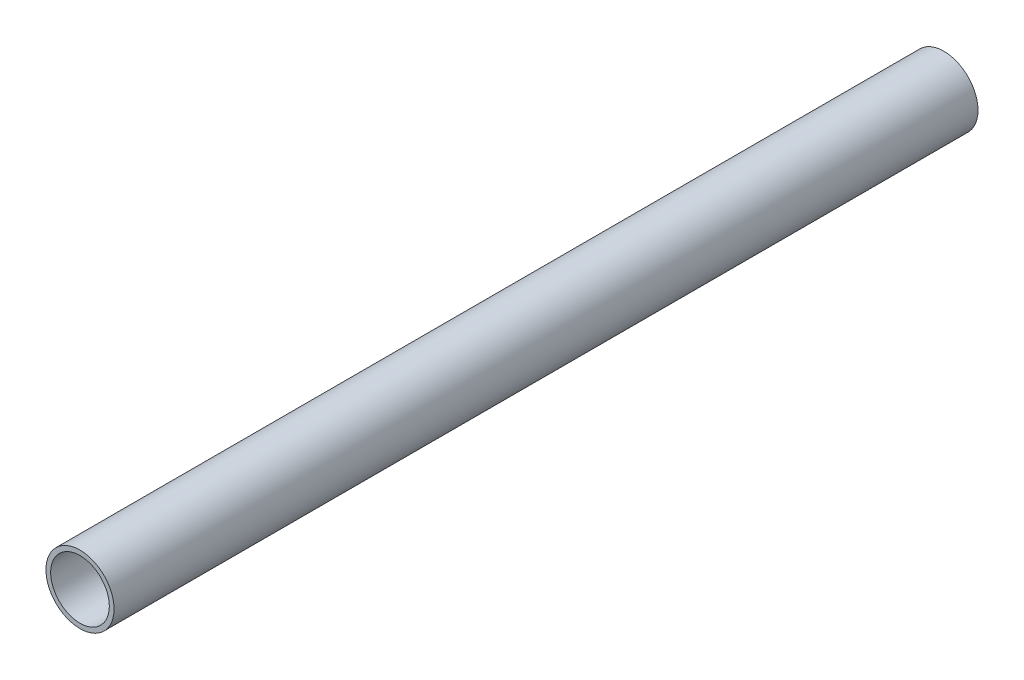
from build123d import *

# Parameters (mm, degrees)
SKETCH_1_R      = 7.55
SKETCH_1_R_2    = 6.5
EXTRUDE_1_DEPTH = 191.55


with BuildPart() as part:
    # 草图1 → 凸台-拉伸1 (new body)
    with BuildSketch(Plane.XY):
        Circle(SKETCH_1_R)
        Circle(SKETCH_1_R_2, mode=Mode.SUBTRACT)
    extrude(amount=EXTRUDE_1_DEPTH)


solid = part.part
